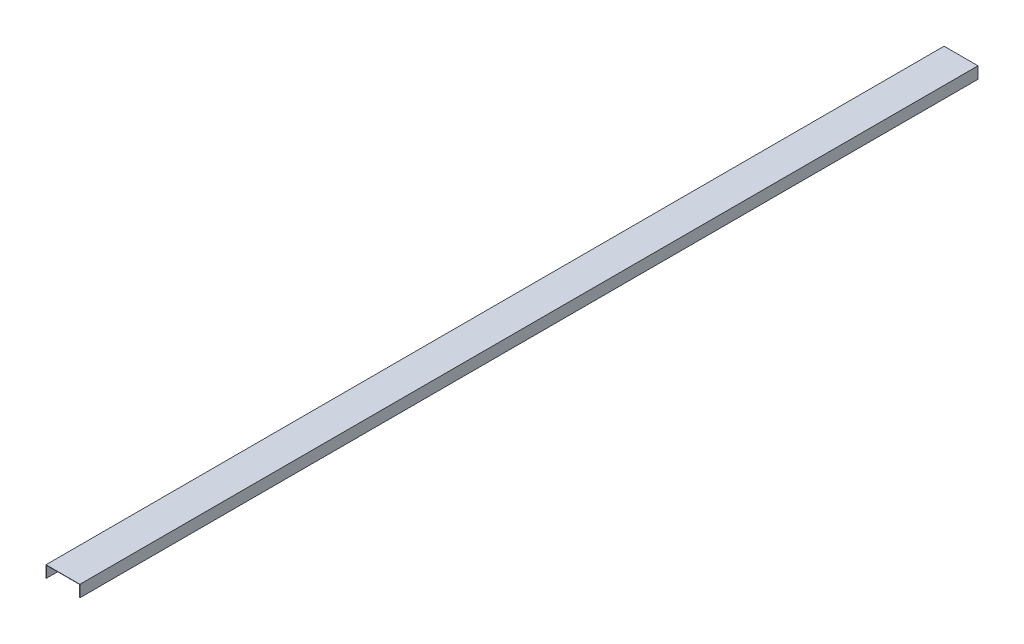
from build123d import *

# Parameters (mm, degrees)
SKETCH1_W           = 92.075
SKETCH1_H           = 2438.4
BOSS_EXTRUDE1_DEPTH = 31.75
SKETCH2_W           = 90.551
SKETCH2_H           = 2438.4
CUT_EXTRUDE1_DEPTH  = 30.988


with BuildPart() as part:
    # Sketch1 → Boss-Extrude1 (new body)
    with BuildSketch(Plane(origin=(0, 0, 0), x_dir=(1, 0, 0), z_dir=(0, 1, 0))):
        Rectangle(SKETCH1_W, SKETCH1_H)
    extrude(amount=BOSS_EXTRUDE1_DEPTH)

    # Sketch2 → Cut-Extrude1 (cut)
    with BuildSketch(Plane(origin=(0, 0, 0), x_dir=(1, 0, 0), z_dir=(0, 1, 0))):
        Rectangle(SKETCH2_W, SKETCH2_H)
    extrude(amount=CUT_EXTRUDE1_DEPTH, mode=Mode.SUBTRACT)


solid = part.part
